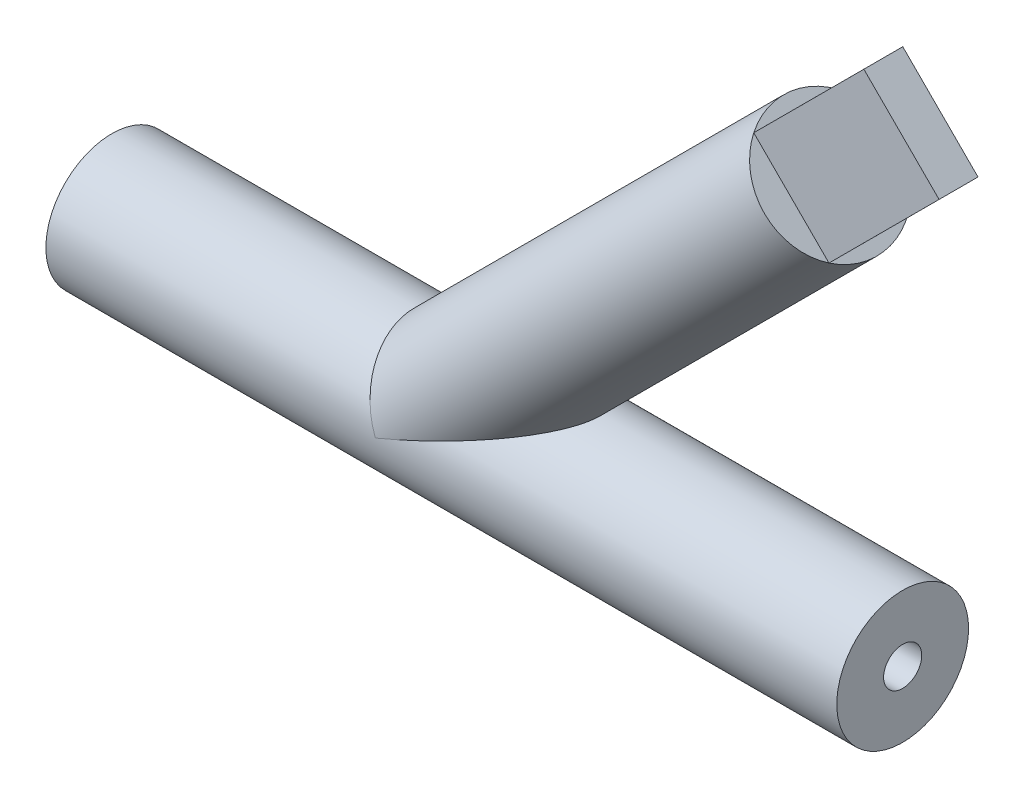
from build123d import *

# Parameters (mm, degrees)
SKETCH1_R           = 12.7
BOSS_EXTRUDE1_DEPTH = 152.4
SKETCH5_R           = 12.7
BOSS_EXTRUDE3_DEPTH = 106
SKETCH6_W           = 7.5
SKETCH6_H           = 20.5
BOSS_EXTRUDE5_DEPTH = 30
SKETCH7_R           = 3.675
CUT_EXTRUDE1_DEPTH  = 152.4


with BuildPart() as part:
    # Sketch1 → Boss-Extrude1 (new body)
    with BuildSketch(Plane(origin=(0, 0, 0), x_dir=(0, 0, -1), z_dir=(1, 0, 0))):
        with Locations(Location((0, 0, 0), (0, 0, 180))):
            Circle(SKETCH1_R)
    extrude(amount=BOSS_EXTRUDE1_DEPTH)

    # Sketch5 → Boss-Extrude3 (add)
    with BuildSketch(Plane(origin=(31.75, 31.75, 0), x_dir=(0.7071067811865464, -0.7071067811865488, 0), z_dir=(0.7071067811865488, 0.7071067811865464, 0))):
        with Locations(Location((44.901280605, 0, 0), (0, 0, 90))):
            Circle(SKETCH5_R)
    extrude(amount=BOSS_EXTRUDE3_DEPTH)

    # Sketch6 → Boss-Extrude5 (add)
    with BuildSketch(Plane(origin=(106.703318806, 106.703318806, 0), x_dir=(0, 0, -1), z_dir=(0.7071067811865487, 0.7071067811865465, 0))):
        with Locations((-3.75, -44.901280605)):
            Rectangle(SKETCH6_W, SKETCH6_H)
    extrude(amount=BOSS_EXTRUDE5_DEPTH)

    # Sketch7 → Cut-Extrude1 (cut)
    with BuildSketch(Plane.ZY):
        Circle(SKETCH7_R)
    extrude(amount=-CUT_EXTRUDE1_DEPTH, mode=Mode.SUBTRACT)


solid = part.part
